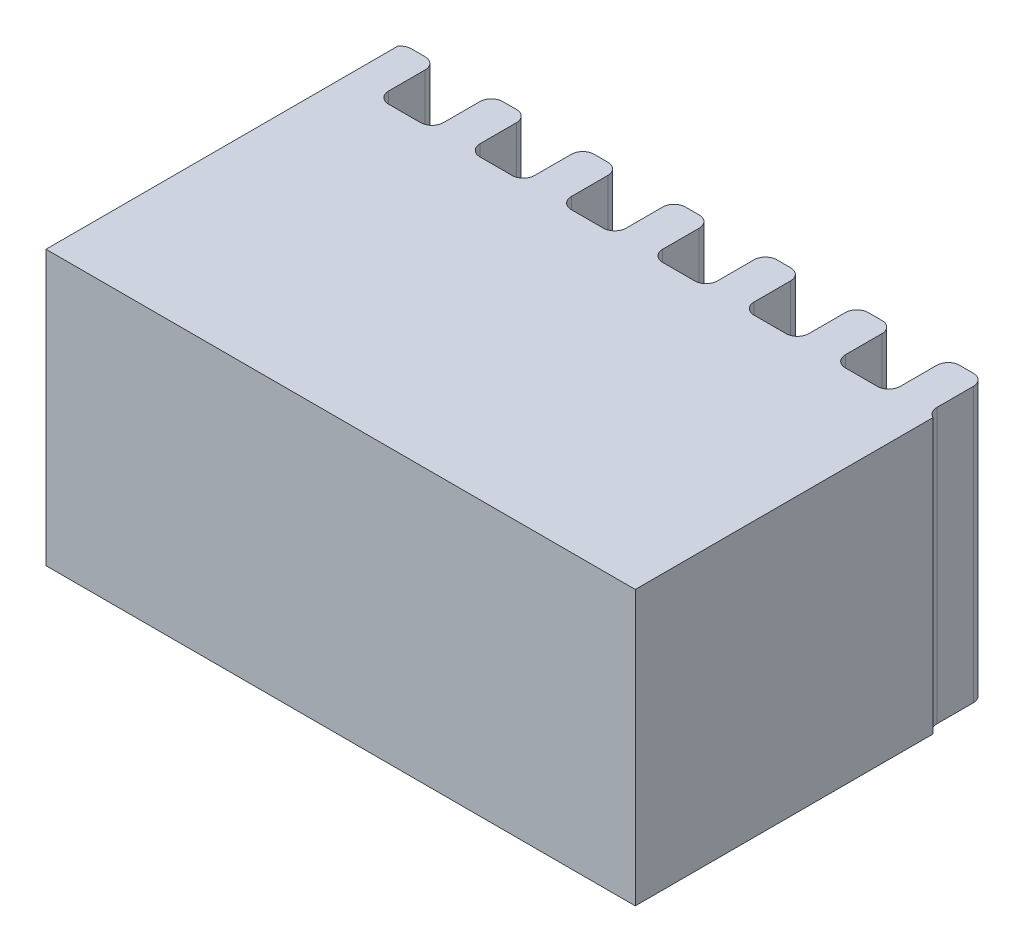
from build123d import *

# Parameters (mm, degrees)
SKETCH_1_W           = 45
SKETCH_1_H           = 26
EXTRUDE_1_DEPTH      = 10
CUT_EXTRUDE_1_DEPTH  = 6
SKETCH_4_W           = 30
SKETCH_4_H           = 1.4
CUT_EXTRUDE_3_DEPTH  = 6
SKETCH_5_R           = 1.8
CUT_EXTRUDE_4_DEPTH  = 30
SKETCH_6_W           = 2.8
SKETCH_6_H           = 6
CUT_EXTRUDE_5_DEPTH  = 6.5
SKETCH_7_W           = 22.3
SKETCH_7_H           = 8.113029467
CUT_EXTRUDE_7_DEPTH  = 6
SKETCH_8_R           = 1.9
CUT_EXTRUDE_8_DEPTH  = 15.9
SKETCH_10_W          = 6
SKETCH_10_H          = 3
CUT_EXTRUDE_9_DEPTH  = 8.5
SKETCH_12_W          = 10.2
SKETCH_12_H          = 4
CUT_EXTRUDE_11_DEPTH = 45
SKETCH_13_W          = 12.9
SKETCH_13_H          = 1.5
CUT_EXTRUDE_12_DEPTH = 6
SKETCH_14_R          = 1.8
CUT_EXTRUDE_13_DEPTH = 6


with BuildPart() as part:
    # 草图1 → 凸台-拉伸1 (new body)
    with BuildSketch(Plane(origin=(0, 0, 0), x_dir=(1, 0, 0), z_dir=(0, 1, 0))):
        with Locations((22.5, 13)):
            Rectangle(SKETCH_1_W, SKETCH_1_H)
    extrude(amount=EXTRUDE_1_DEPTH)

    # 草图3 → 切除-拉伸1 (cut)
    with BuildSketch(Plane(origin=(0, 10, 0), x_dir=(1, 0, 0), z_dir=(0, 1, 0))):
        with BuildLine():
            Line((43, 8), (43.7, 8))
            ThreePointArc((43.7, 8), (43.876776695, 8.073223305), (43.95, 8.25))
            Line((43.95, 8.25), (43.95, 9.05))
            ThreePointArc((43.95, 9.05), (44.023223305, 9.226776695), (44.2, 9.3))
            Line((44.2, 9.3), (44.5, 9.3))
            ThreePointArc((44.5, 9.3), (44.676776695, 9.226776695), (44.75, 9.05))
            Line((44.75, 9.05), (44.75, 8.25))
            ThreePointArc((44.75, 8.25), (44.823223305, 8.073223305), (45, 8))
            Line((45, 8), (45, 10.2))
            Line((45, 10.2), (0, 10.2))
            Line((0, 10.2), (0, 9.2))
            ThreePointArc((0, 9.2), (0.088196601, 9.273606798), (0.2, 9.3))
            Line((0.2, 9.3), (0.5, 9.3))
            ThreePointArc((0.5, 9.3), (0.676776695, 9.226776695), (0.75, 9.05))
            Line((0.75, 9.05), (0.75, 8.25))
            ThreePointArc((0.75, 8.25), (0.823223305, 8.073223305), (1, 8))
            Line((1, 8), (1.7, 8))
            ThreePointArc((1.7, 8), (1.876776695, 8.073223305), (1.95, 8.25))
            Line((1.95, 8.25), (1.95, 9.05))
            ThreePointArc((1.95, 9.05), (2.023223305, 9.226776695), (2.2, 9.3))
            Line((2.2, 9.3), (2.5, 9.3))
            ThreePointArc((2.5, 9.3), (2.676776695, 9.226776695), (2.75, 9.05))
            Line((2.75, 9.05), (2.75, 8.25))
            ThreePointArc((2.75, 8.25), (2.823223305, 8.073223305), (3, 8))
            Line((3, 8), (3.7, 8))
            ThreePointArc((3.7, 8), (3.876776695, 8.073223305), (3.95, 8.25))
            Line((3.95, 8.25), (3.95, 9.05))
            ThreePointArc((3.95, 9.05), (4.023223305, 9.226776695), (4.2, 9.3))
            Line((4.2, 9.3), (4.5, 9.3))
            ThreePointArc((4.5, 9.3), (4.676776695, 9.226776695), (4.75, 9.05))
            Line((4.75, 9.05), (4.75, 8.25))
            ThreePointArc((4.75, 8.25), (4.823223305, 8.073223305), (5, 8))
            Line((5, 8), (5.7, 8))
            ThreePointArc((5.7, 8), (5.876776695, 8.073223305), (5.95, 8.25))
            Line((5.95, 8.25), (5.95, 9.05))
            ThreePointArc((5.95, 9.05), (6.023223305, 9.226776695), (6.2, 9.3))
            Line((6.2, 9.3), (6.5, 9.3))
            ThreePointArc((6.5, 9.3), (6.676776695, 9.226776695), (6.75, 9.05))
            Line((6.75, 9.05), (6.75, 8.25))
            ThreePointArc((6.75, 8.25), (6.823223305, 8.073223305), (7, 8))
            Line((7, 8), (7.7, 8))
            ThreePointArc((7.7, 8), (7.876776695, 8.073223305), (7.95, 8.25))
            Line((7.95, 8.25), (7.95, 9.05))
            ThreePointArc((7.95, 9.05), (8.023223305, 9.226776695), (8.2, 9.3))
            Line((8.2, 9.3), (8.5, 9.3))
            ThreePointArc((8.5, 9.3), (8.676776695, 9.226776695), (8.75, 9.05))
            Line((8.75, 9.05), (8.75, 8.25))
            ThreePointArc((8.75, 8.25), (8.823223305, 8.073223305), (9, 8))
            Line((9, 8), (9.7, 8))
            ThreePointArc((9.7, 8), (9.876776695, 8.073223305), (9.95, 8.25))
            Line((9.95, 8.25), (9.95, 9.05))
            ThreePointArc((9.95, 9.05), (10.023223305, 9.226776695), (10.2, 9.3))
            Line((10.2, 9.3), (10.5, 9.3))
            ThreePointArc((10.5, 9.3), (10.676776695, 9.226776695), (10.75, 9.05))
            Line((10.75, 9.05), (10.75, 8.25))
            ThreePointArc((10.75, 8.25), (10.823223305, 8.073223305), (11, 8))
            Line((11, 8), (11.7, 8))
            ThreePointArc((11.7, 8), (11.876776695, 8.073223305), (11.95, 8.25))
            Line((11.95, 8.25), (11.95, 9.05))
            ThreePointArc((11.95, 9.05), (12.023223305, 9.226776695), (12.2, 9.3))
            Line((12.2, 9.3), (12.5, 9.3))
            ThreePointArc((12.5, 9.3), (12.676776695, 9.226776695), (12.75, 9.05))
            Line((12.75, 9.05), (12.75, 8.25))
            ThreePointArc((12.75, 8.25), (12.823223305, 8.073223305), (13, 8))
            Line((13, 8), (13.7, 8))
            ThreePointArc((13.7, 8), (13.876776695, 8.073223305), (13.95, 8.25))
            Line((13.95, 8.25), (13.95, 9.05))
            ThreePointArc((13.95, 9.05), (14.023223305, 9.226776695), (14.2, 9.3))
            Line((14.2, 9.3), (14.5, 9.3))
            ThreePointArc((14.5, 9.3), (14.676776695, 9.226776695), (14.75, 9.05))
            Line((14.75, 9.05), (14.75, 8.25))
            ThreePointArc((14.75, 8.25), (14.823223305, 8.073223305), (15, 8))
            Line((15, 8), (15.7, 8))
            ThreePointArc((15.7, 8), (15.876776695, 8.073223305), (15.95, 8.25))
            Line((15.95, 8.25), (15.95, 9.05))
            ThreePointArc((15.95, 9.05), (16.023223305, 9.226776695), (16.2, 9.3))
            Line((16.2, 9.3), (16.5, 9.3))
            ThreePointArc((16.5, 9.3), (16.676776695, 9.226776695), (16.75, 9.05))
            Line((16.75, 9.05), (16.75, 8.25))
            ThreePointArc((16.75, 8.25), (16.823223305, 8.073223305), (17, 8))
            Line((17, 8), (17.7, 8))
            ThreePointArc((17.7, 8), (17.876776695, 8.073223305), (17.95, 8.25))
            Line((17.95, 8.25), (17.95, 9.05))
            ThreePointArc((17.95, 9.05), (18.023223305, 9.226776695), (18.2, 9.3))
            Line((18.2, 9.3), (18.5, 9.3))
            ThreePointArc((18.5, 9.3), (18.676776695, 9.226776695), (18.75, 9.05))
            Line((18.75, 9.05), (18.75, 8.25))
            ThreePointArc((18.75, 8.25), (18.823223305, 8.073223305), (19, 8))
            Line((19, 8), (19.7, 8))
            ThreePointArc((19.7, 8), (19.876776695, 8.073223305), (19.95, 8.25))
            Line((19.95, 8.25), (19.95, 9.05))
            ThreePointArc((19.95, 9.05), (20.023223305, 9.226776695), (20.2, 9.3))
            Line((20.2, 9.3), (20.5, 9.3))
            ThreePointArc((20.5, 9.3), (20.676776695, 9.226776695), (20.75, 9.05))
            Line((20.75, 9.05), (20.75, 8.25))
            ThreePointArc((20.75, 8.25), (20.823223305, 8.073223305), (21, 8))
            Line((21, 8), (21.7, 8))
            ThreePointArc((21.7, 8), (21.876776695, 8.073223305), (21.95, 8.25))
            Line((21.95, 8.25), (21.95, 9.05))
            ThreePointArc((21.95, 9.05), (22.023223305, 9.226776695), (22.2, 9.3))
            Line((22.2, 9.3), (22.5, 9.3))
            ThreePointArc((22.5, 9.3), (22.676776695, 9.226776695), (22.75, 9.05))
            Line((22.75, 9.05), (22.75, 8.25))
            ThreePointArc((22.75, 8.25), (22.823223305, 8.073223305), (23, 8))
            Line((23, 8), (23.7, 8))
            ThreePointArc((23.7, 8), (23.876776695, 8.073223305), (23.95, 8.25))
            Line((23.95, 8.25), (23.95, 9.05))
            ThreePointArc((23.95, 9.05), (24.023223305, 9.226776695), (24.2, 9.3))
            Line((24.2, 9.3), (24.5, 9.3))
            ThreePointArc((24.5, 9.3), (24.676776695, 9.226776695), (24.75, 9.05))
            Line((24.75, 9.05), (24.75, 8.25))
            ThreePointArc((24.75, 8.25), (24.823223305, 8.073223305), (25, 8))
            Line((25, 8), (25.7, 8))
            ThreePointArc((25.7, 8), (25.876776695, 8.073223305), (25.95, 8.25))
            Line((25.95, 8.25), (25.95, 9.05))
            ThreePointArc((25.95, 9.05), (26.023223305, 9.226776695), (26.2, 9.3))
            Line((26.2, 9.3), (26.5, 9.3))
            ThreePointArc((26.5, 9.3), (26.676776695, 9.226776695), (26.75, 9.05))
            Line((26.75, 9.05), (26.75, 8.25))
            ThreePointArc((26.75, 8.25), (26.823223305, 8.073223305), (27, 8))
            Line((27, 8), (27.7, 8))
            ThreePointArc((27.7, 8), (27.876776695, 8.073223305), (27.95, 8.25))
            Line((27.95, 8.25), (27.95, 9.05))
            ThreePointArc((27.95, 9.05), (28.023223305, 9.226776695), (28.2, 9.3))
            Line((28.2, 9.3), (28.5, 9.3))
            ThreePointArc((28.5, 9.3), (28.676776695, 9.226776695), (28.75, 9.05))
            Line((28.75, 9.05), (28.75, 8.25))
            ThreePointArc((28.75, 8.25), (28.823223305, 8.073223305), (29, 8))
            Line((29, 8), (29.7, 8))
            ThreePointArc((29.7, 8), (29.876776695, 8.073223305), (29.95, 8.25))
            Line((29.95, 8.25), (29.95, 9.05))
            ThreePointArc((29.95, 9.05), (30.023223305, 9.226776695), (30.2, 9.3))
            Line((30.2, 9.3), (30.5, 9.3))
            ThreePointArc((30.5, 9.3), (30.676776695, 9.226776695), (30.75, 9.05))
            Line((30.75, 9.05), (30.75, 8.25))
            ThreePointArc((30.75, 8.25), (30.823223305, 8.073223305), (31, 8))
            Line((31, 8), (31.7, 8))
            ThreePointArc((31.7, 8), (31.876776695, 8.073223305), (31.95, 8.25))
            Line((31.95, 8.25), (31.95, 9.05))
            ThreePointArc((31.95, 9.05), (32.023223305, 9.226776695), (32.2, 9.3))
            Line((32.2, 9.3), (32.5, 9.3))
            ThreePointArc((32.5, 9.3), (32.676776695, 9.226776695), (32.75, 9.05))
            Line((32.75, 9.05), (32.75, 8.25))
            ThreePointArc((32.75, 8.25), (32.823223305, 8.073223305), (33, 8))
            Line((33, 8), (33.7, 8))
            ThreePointArc((33.7, 8), (33.876776695, 8.073223305), (33.95, 8.25))
            Line((33.95, 8.25), (33.95, 9.05))
            ThreePointArc((33.95, 9.05), (34.023223305, 9.226776695), (34.2, 9.3))
            Line((34.2, 9.3), (34.5, 9.3))
            ThreePointArc((34.5, 9.3), (34.676776695, 9.226776695), (34.75, 9.05))
            Line((34.75, 9.05), (34.75, 8.25))
            ThreePointArc((34.75, 8.25), (34.823223305, 8.073223305), (35, 8))
            Line((35, 8), (35.7, 8))
            ThreePointArc((35.7, 8), (35.876776695, 8.073223305), (35.95, 8.25))
            Line((35.95, 8.25), (35.95, 9.05))
            ThreePointArc((35.95, 9.05), (36.023223305, 9.226776695), (36.2, 9.3))
            Line((36.2, 9.3), (36.5, 9.3))
            ThreePointArc((36.5, 9.3), (36.676776695, 9.226776695), (36.75, 9.05))
            Line((36.75, 9.05), (36.75, 8.25))
            ThreePointArc((36.75, 8.25), (36.823223305, 8.073223305), (37, 8))
            Line((37, 8), (37.7, 8))
            ThreePointArc((37.7, 8), (37.876776695, 8.073223305), (37.95, 8.25))
            Line((37.95, 8.25), (37.95, 9.05))
            ThreePointArc((37.95, 9.05), (38.023223305, 9.226776695), (38.2, 9.3))
            Line((38.2, 9.3), (38.5, 9.3))
            ThreePointArc((38.5, 9.3), (38.676776695, 9.226776695), (38.75, 9.05))
            Line((38.75, 9.05), (38.75, 8.25))
            ThreePointArc((38.75, 8.25), (38.823223305, 8.073223305), (39, 8))
            Line((39, 8), (39.7, 8))
            ThreePointArc((39.7, 8), (39.876776695, 8.073223305), (39.95, 8.25))
            Line((39.95, 8.25), (39.95, 9.05))
            ThreePointArc((39.95, 9.05), (40.023223305, 9.226776695), (40.2, 9.3))
            Line((40.2, 9.3), (40.5, 9.3))
            ThreePointArc((40.5, 9.3), (40.676776695, 9.226776695), (40.75, 9.05))
            Line((40.75, 9.05), (40.75, 8.25))
            ThreePointArc((40.75, 8.25), (40.823223305, 8.073223305), (41, 8))
            Line((41, 8), (41.7, 8))
            ThreePointArc((41.7, 8), (41.876776695, 8.073223305), (41.95, 8.25))
            Line((41.95, 8.25), (41.95, 9.05))
            ThreePointArc((41.95, 9.05), (42.023223305, 9.226776695), (42.2, 9.3))
            Line((42.2, 9.3), (42.5, 9.3))
            ThreePointArc((42.5, 9.3), (42.676776695, 9.226776695), (42.75, 9.05))
            Line((42.75, 9.05), (42.75, 8.25))
            ThreePointArc((42.75, 8.25), (42.823223305, 8.073223305), (43, 8))
        make_face()
    extrude(amount=-CUT_EXTRUDE_1_DEPTH, mode=Mode.SUBTRACT)

    # 草图4 → 切除-拉伸3 (cut)
    with BuildSketch(Plane(origin=(0, 10, 0), x_dir=(1, 0, 0), z_dir=(0, 1, 0))):
        with Locations((30, 8.7)):
            Rectangle(SKETCH_4_W, SKETCH_4_H)
    extrude(amount=-CUT_EXTRUDE_3_DEPTH, mode=Mode.SUBTRACT)

    # 草图5 → 切除-拉伸4 (cut)
    with BuildSketch(Plane(origin=(45, 0, 0), x_dir=(0, 0, -1), z_dir=(1, 0, 0))):
        with Locations((4.5, 7)):
            Circle(SKETCH_5_R)
    extrude(amount=-CUT_EXTRUDE_4_DEPTH, mode=Mode.SUBTRACT)

    # 草图6 → 切除-拉伸5 (cut)
    with BuildSketch(Plane(origin=(0, 10, 0), x_dir=(1, 0, 0), z_dir=(0, 1, 0))):
        with Locations((38.6, 4.5)):
            Rectangle(SKETCH_6_W, SKETCH_6_H)
    extrude(amount=-CUT_EXTRUDE_5_DEPTH, mode=Mode.SUBTRACT)

    # 草图7 → 切除-拉伸7 (cut)
    with BuildSketch(Plane(origin=(0, 10, 0), x_dir=(1, 0, 0), z_dir=(0, 1, 0))):
        with Locations((24.05, 5.556514734)):
            Rectangle(SKETCH_7_W, SKETCH_7_H)
    extrude(amount=-CUT_EXTRUDE_7_DEPTH, mode=Mode.SUBTRACT)

    # 草图8 → 切除-拉伸8 (cut)
    with BuildSketch(Plane(origin=(0, 0, -26), x_dir=(-1, 0, 0), z_dir=(0, 0, -1))):
        with Locations((-10, 5)):
            Circle(SKETCH_8_R)
        with Locations(Location((-35, 5, 0), (0, 0, 328.243136141))):
            Circle(SKETCH_8_R)
    extrude(amount=-CUT_EXTRUDE_8_DEPTH, mode=Mode.SUBTRACT)

    # 草图10 → 切除-拉伸9 (cut)
    with BuildSketch(Plane(origin=(0, 10, 0), x_dir=(1, 0, 0), z_dir=(0, 1, 0))):
        with Locations((10, 21.5)):
            Rectangle(SKETCH_10_W, SKETCH_10_H)
        with Locations((35, 21.5)):
            Rectangle(SKETCH_10_W, SKETCH_10_H)
    extrude(amount=-CUT_EXTRUDE_9_DEPTH, mode=Mode.SUBTRACT)

    # 草图12 → 切除-拉伸11 (cut)
    with BuildSketch(Plane.ZY):
        with Locations((-5.1, 2)):
            Rectangle(SKETCH_12_W, SKETCH_12_H)
    extrude(amount=-CUT_EXTRUDE_11_DEPTH, mode=Mode.SUBTRACT)


with BuildPart() as body_2:
    # of the pieces the cut leaves, the one that is kept (cut_extrude_11_keep)
    add(part.part.solids().sort_by_distance((0, 4, 0))[0])

    # 草图13 → 切除-拉伸12 (cut)
    with BuildSketch(Plane(origin=(0, 10, 0), x_dir=(1, 0, 0), z_dir=(0, 1, 0))):
        with Locations((6.45, 0.75)):
            Rectangle(SKETCH_13_W, SKETCH_13_H)
    extrude(amount=-CUT_EXTRUDE_12_DEPTH, mode=Mode.SUBTRACT)


with BuildPart() as body_2_2:
    # of the pieces the cut leaves, the one that is kept (cut_extrude_12_keep)
    add(body_2.part.solids().sort_by_distance((0, 4, -9.2))[0])

    # 草图14 → 切除-拉伸13 (cut)
    with BuildSketch(Plane.ZY):
        with Locations((-4.5, 7)):
            Circle(SKETCH_14_R)
    extrude(amount=-CUT_EXTRUDE_13_DEPTH, mode=Mode.SUBTRACT)


solid = body_2_2.part
